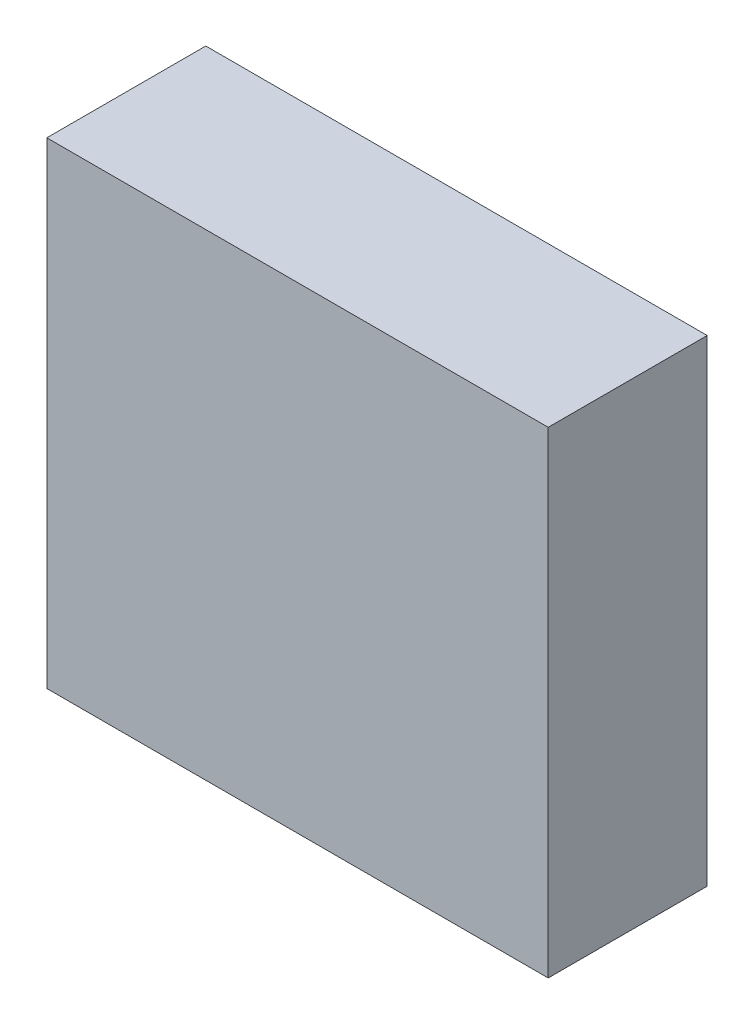
from build123d import *

# Parameters (mm, degrees)
SKETCH1_W           = 40.0558
SKETCH1_H           = 12.7
BOSS_EXTRUDE1_DEPTH = 38.1


with BuildPart() as part:
    # Sketch1 → Boss-Extrude1 (new body)
    with BuildSketch(Plane(origin=(0, 0, 0), x_dir=(1, 0, 0), z_dir=(0, 1, 0))):
        with Locations((20.0279, 6.35)):
            Rectangle(SKETCH1_W, SKETCH1_H)
    extrude(amount=BOSS_EXTRUDE1_DEPTH)


solid = part.part
